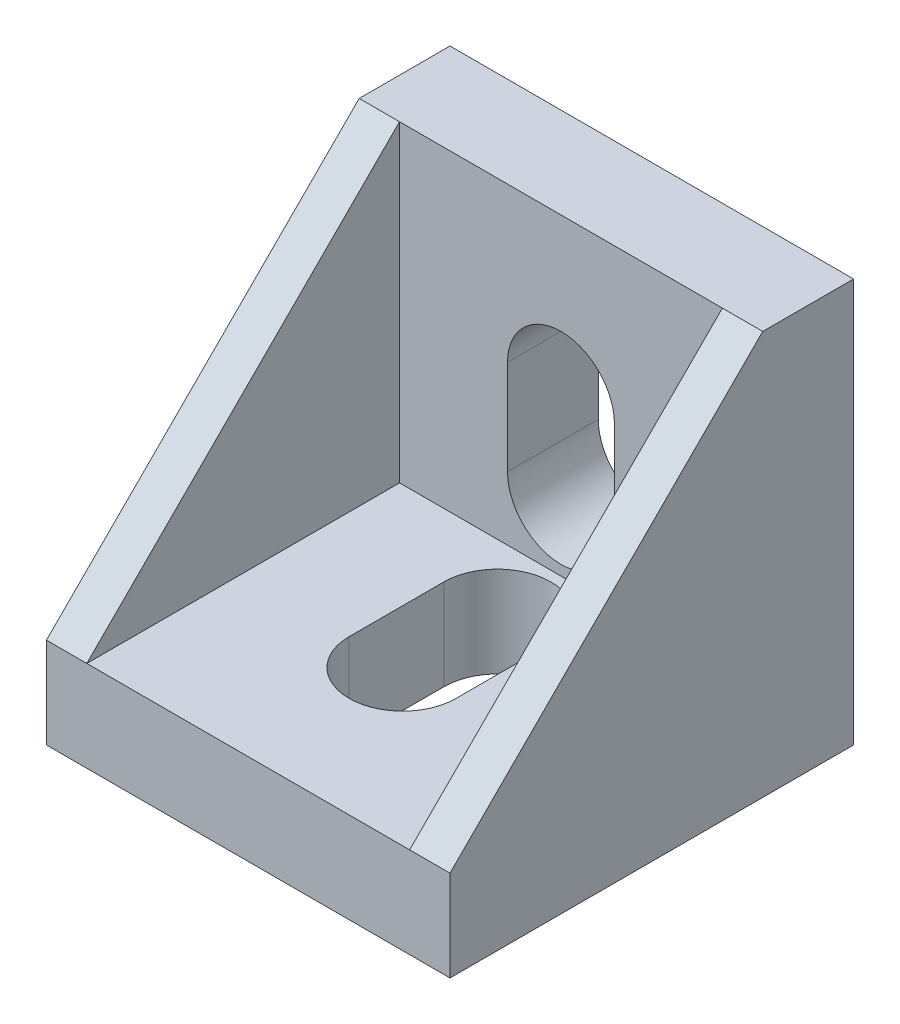
from build123d import *

# Parameters (mm, degrees)
SKETCH1_W           = 20
SKETCH1_H           = 20
BOSS_EXTRUDE1_DEPTH = 4.5
SKETCH2_W           = 20
SKETCH2_H           = 4.5
BOSS_EXTRUDE2_DEPTH = 4.5
BOSS_EXTRUDE3_DEPTH = 2


with BuildPart() as part:
    # Sketch1 → Boss-Extrude1 (new body)
    with BuildSketch(Plane.XY):
        with Locations((10, 2.82300885)):
            Rectangle(SKETCH1_W, SKETCH1_H)
        with BuildLine():
            Line((7.35, 5.17300885), (7.35, 0.47300885))
            ThreePointArc((7.35, 0.47300885), (10, -2.17699115), (12.65, 0.47300885))
            Line((12.65, 0.47300885), (12.65, 5.17300885))
            ThreePointArc((12.65, 5.17300885), (10, 7.82300885), (7.35, 5.17300885))
        make_face(mode=Mode.SUBTRACT)
    extrude(amount=BOSS_EXTRUDE1_DEPTH)

    # Sketch2 → Boss-Extrude2 (add)
    with BuildSketch(Plane.XZ.offset(7.17699115)):
        with Locations((10, 2.25)):
            Rectangle(SKETCH2_W, SKETCH2_H)
        with BuildLine():
            Line((0, 10), (0, 4.5))
            Line((0, 4.5), (20, 4.5))
            Line((20, 4.5), (20, 10))
            Line((20, 10), (12.65, 10))
            Line((12.65, 10), (12.65, 7.65))
            ThreePointArc((12.65, 7.65), (10, 5), (7.35, 7.65))
            Line((7.35, 7.65), (7.35, 10))
            Line((7.35, 10), (0, 10))
        make_face()
        with BuildLine():
            Line((0, 20), (0, 10))
            Line((0, 10), (7.35, 10))
            Line((7.35, 10), (7.35, 12.35))
            ThreePointArc((7.35, 12.35), (10, 15), (12.65, 12.35))
            Line((12.65, 12.35), (12.65, 10))
            Line((12.65, 10), (20, 10))
            Line((20, 10), (20, 20))
            Line((20, 20), (0, 20))
        make_face()
    extrude(amount=-BOSS_EXTRUDE2_DEPTH)

    # Sketch4 → Boss-Extrude3 (add)
    with BuildSketch(Plane(origin=(20, 0, 0), x_dir=(0, 0, -1), z_dir=(1, 0, 0))):
        Polygon((-20, -2.67699115), (-4.5, 12.82300885), (-4.5, -2.67699115), align=None)
    boss_extrude3 = extrude(amount=-BOSS_EXTRUDE3_DEPTH)

    # Mirror1: Boss-Extrude3 across plane
    add(boss_extrude3.mirror(Plane(origin=(10, 0, 0), x_dir=(0, 0, 1), z_dir=(1, 0, 0))))


solid = part.part
